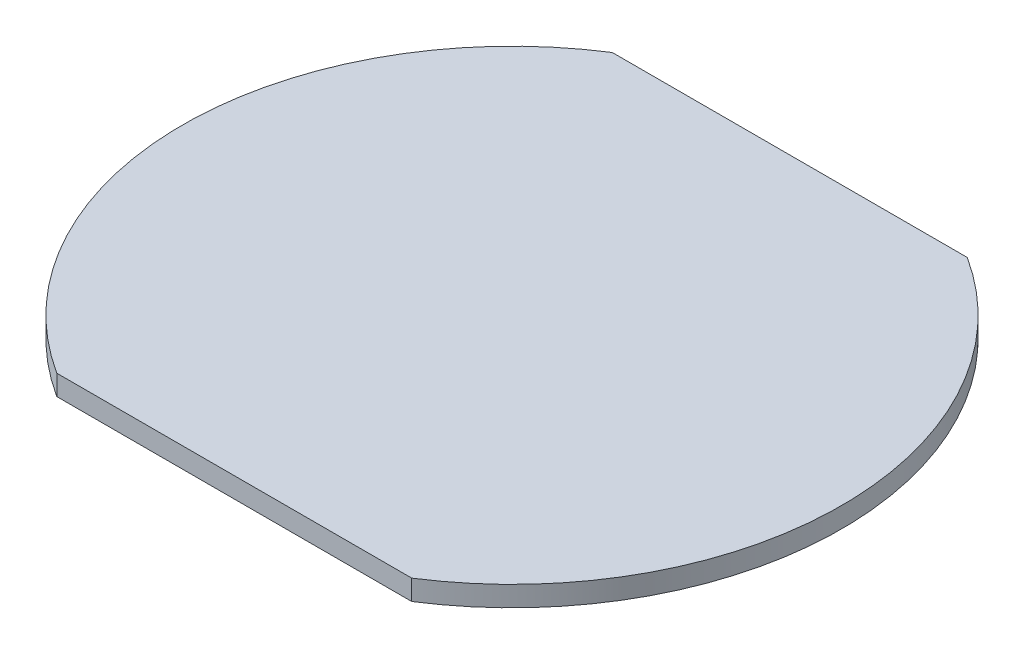
from build123d import *

# Parameters (mm, degrees)
SKETCH1_R           = 32.5
BOSS_EXTRUDE1_DEPTH = 2
CUT_EXTRUDE1_START  = -2
CUT_EXTRUDE1_DEPTH  = 2


with BuildPart() as part:
    # Sketch1 → Boss-Extrude1 (new body)
    with BuildSketch(Plane(origin=(0, 0, 0), x_dir=(1, 0, 0), z_dir=(0, 1, 0))):
        with Locations(Location((0, 0, 0), (0, 0, 270))):
            Circle(SKETCH1_R)
    extrude(amount=BOSS_EXTRUDE1_DEPTH)

    # Sketch2 → Cut-Extrude1 (cut)
    with BuildSketch(Plane(origin=(0, 2, 0), x_dir=(1, 0, 0), z_dir=(0, 1, 0)).offset(CUT_EXTRUDE1_START)):
        with BuildLine():
            Line((17.5, 27.386127875), (-17.5, 27.386127875))
            ThreePointArc((-17.5, 27.386127875), (0, 32.5), (17.5, 27.386127875))
        make_face()
        with BuildLine():
            Line((17.5, -27.386127875), (-17.5, -27.386127875))
            ThreePointArc((-17.5, -27.386127875), (0, -32.5), (17.5, -27.386127875))
        make_face()
    extrude(amount=CUT_EXTRUDE1_DEPTH, mode=Mode.SUBTRACT)


solid = part.part
